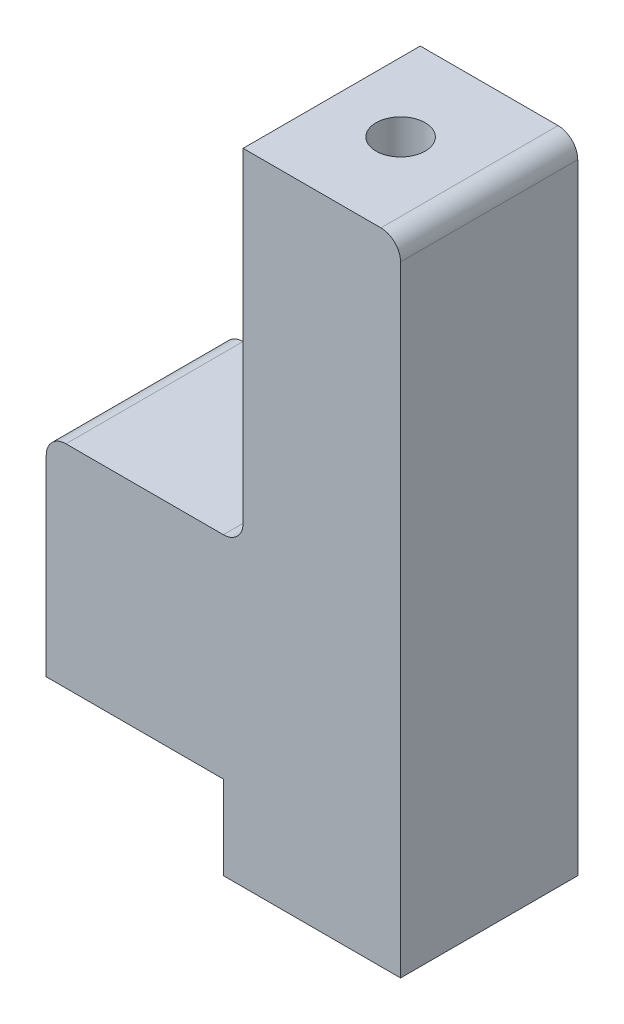
from build123d import *

# Parameters (mm, degrees)
SKETCH1_W           = 9
SKETCH1_H           = 9
BOSS_EXTRUDE1_DEPTH = 15
SKETCH2_R           = 3.75
CUT_EXTRUDE1_DEPTH  = 5
SKETCH3_W           = 9
SKETCH3_H           = 9
BOSS_EXTRUDE2_DEPTH = 20
BOSS_EXTRUDE3_REACH = 25.859
SKETCH6_W           = 10
SKETCH6_H           = 9
CUT_EXTRUDE3_DEPTH  = 5
FILLET2_R           = 1
SKETCH7_W           = 8
SKETCH7_H           = 9
BOSS_EXTRUDE4_DEPTH = 12.5
SKETCH4_R           = 1.25
CUT_EXTRUDE2_DEPTH  = 36.478866949
FILLET3_R           = 1


with BuildPart() as part:
    # Sketch1 → Boss-Extrude1 (new body)
    with BuildSketch(Plane(origin=(0, 0, 0), x_dir=(1, 0, 0), z_dir=(0, 1, 0))):
        Rectangle(SKETCH1_W, SKETCH1_H)
    extrude(amount=BOSS_EXTRUDE1_DEPTH)

    # Sketch2 → Cut-Extrude1 (cut)
    with BuildSketch(Plane.XZ):
        with Locations(Location((0, 0, 0), (0, 0, 270))):
            Circle(SKETCH2_R)
    extrude(amount=-CUT_EXTRUDE1_DEPTH, mode=Mode.SUBTRACT)

    # Sketch3 → Boss-Extrude2 (add)
    with BuildSketch(Plane(origin=(0, 15, 0), x_dir=(1, 0, 0), z_dir=(0, 1, 0))):
        with Locations((9, 0)):
            Rectangle(SKETCH3_W, SKETCH3_H)
    extrude(amount=-BOSS_EXTRUDE2_DEPTH)

    # Boss-Extrude3: up to this face of the body (flat: up to its plane)
    boss_extrude3_end = Plane(part.part.faces().sort_by_distance((4.5, -2.5, 0))[0])
    # Sketch5 → Boss-Extrude3 (add, up to the picked face)
    with BuildSketch(Plane.ZY.offset(4.5), mode=Mode.PRIVATE) as boss_extrude3_sk1:
        with BuildLine():
            Line((4.5, -0.75), (4.5, 0))
            Line((4.5, 0), (3.75, 0))
            ThreePointArc((3.75, 0), (4.280330086, -0.219669914), (4.5, -0.75))
        make_face()
    boss_extrude3_tool1 = split(extrude(boss_extrude3_sk1.sketch, amount=-BOSS_EXTRUDE3_REACH, mode=Mode.PRIVATE), bisect_by=boss_extrude3_end, keep=Keep.BOTH, mode=Mode.PRIVATE)
    add(boss_extrude3_tool1.solids().sort_by(Axis((-4.5, -0.167526, 4.332474), (1, 0, 0)))[0])

    # Sketch6 → Cut-Extrude3 (cut)
    with BuildSketch(Plane(origin=(0, 15, 0), x_dir=(1, 0, 0), z_dir=(0, 1, 0))):
        with Locations((0.5, 0)):
            Rectangle(SKETCH6_W, SKETCH6_H)
    extrude(amount=-CUT_EXTRUDE3_DEPTH, mode=Mode.SUBTRACT)

    # Fillet2
    fillet2_edges = [part.edges().sort_by_distance(p)[0] for p in [
        (-4.5, 10, 0),
        (5.5, 10, 0),
    ]]
    fillet(fillet2_edges, radius=FILLET2_R)

    # Sketch7 → Boss-Extrude4 (add)
    with BuildSketch(Plane(origin=(0, 15, 0), x_dir=(1, 0, 0), z_dir=(0, 1, 0))):
        with Locations((9.5, 0)):
            Rectangle(SKETCH7_W, SKETCH7_H)
    extrude(amount=BOSS_EXTRUDE4_DEPTH)

    # Sketch4 → Cut-Extrude2 (cut, through all)
    with BuildSketch(Plane.XZ.offset(5)):
        with Locations(Location((9, 0, 0), (0, 0, 270))):
            Circle(SKETCH4_R)
    extrude(amount=-CUT_EXTRUDE2_DEPTH, mode=Mode.SUBTRACT)

    # Fillet3
    fillet3_edges = [part.edges().sort_by_distance(p)[0] for p in [
        (13.5, 27.5, 0),
    ]]
    fillet(fillet3_edges, radius=FILLET3_R)


solid = part.part
